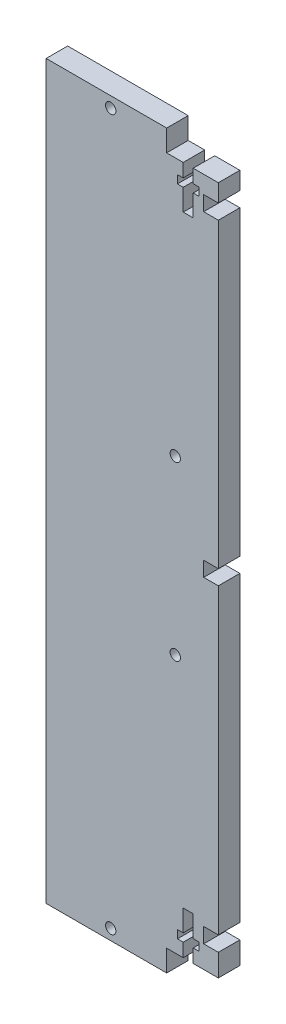
from build123d import *

# Parameters (mm, degrees)
SKETCH1_W                                   = 152.4
SKETCH1_H                                   = 215.9
BOSS_EXTRUDE1_DEPTH                         = 6.35
SKETCH2_R                                   = 1.524
CUT_EXTRUDE1_DEPTH                          = 265.346160366
SKETCH4_R                                   = 1.524
CUT_EXTRUDE2_DEPTH                          = 265.346160366
SKETCH5_R                                   = 1.524
CUT_EXTRUDE3_DEPTH                          = 265.346160366
SKETCH9_W                                   = 81.28
SKETCH9_H                                   = 6.35
CUT_EXTRUDE9_DEPTH                          = 265.346160366
CUT_EXTRUDE10_DEPTH                         = 265.346160366
SKETCH11_W                                  = 50.8
SKETCH11_H                                  = 203.2
CUT_EXTRUDE11_DEPTH                         = 61.976
SKETCH13_W                                  = 4.318
SKETCH13_H                                  = 4.439032047
SKETCH13_H_2                                = 4.376890529
CUT_EXTRUDE12_DEPTH                         = 6.35
SKETCH14_W                                  = 4.318
SKETCH14_H                                  = 4.368724603
CUT_EXTRUDE13_DEPTH                         = 6.35
SKETCH15_W                                  = 125.806146595
SKETCH15_H                                  = 228.6
GETTING_RID_OF_TOP_IMPINGES_WITH_DOOR_DEPTH = 265.346160366


with BuildPart() as part:
    # Sketch1 → Boss-Extrude1 (new body)
    with BuildSketch(Plane.XY):
        with Locations((76.2, 107.95)):
            Rectangle(SKETCH1_W, SKETCH1_H)
    extrude(amount=BOSS_EXTRUDE1_DEPTH)

    # Sketch2 → Cut-Extrude1 (cut, through all)
    with BuildSketch(Plane.XY.offset(6.35)):
        with Locations((19.05, 212.725)):
            Circle(SKETCH2_R)
        with Locations(Location((133.35, 212.725, 0), (0, 0, 180))):
            Circle(SKETCH2_R)
        with Locations((133.35, 3.175)):
            Circle(SKETCH2_R)
        with Locations(Location((19.05, 3.175, 0), (0, 0, 180))):
            Circle(SKETCH2_R)
    extrude(amount=-CUT_EXTRUDE1_DEPTH, mode=Mode.SUBTRACT)

    # Sketch4 → Cut-Extrude2 (cut, through all)
    with BuildSketch(Plane.XY.offset(6.35)):
        with Locations(Location((95.25, 133.35, 0), (0, 0, 180))):
            Circle(SKETCH4_R)
        with Locations((95.25, 82.55)):
            Circle(SKETCH4_R)
    extrude(amount=-CUT_EXTRUDE2_DEPTH, mode=Mode.SUBTRACT)

    # Sketch5 → Cut-Extrude3 (cut, through all)
    with BuildSketch(Plane.XY.offset(6.35)):
        with Locations((38.1, 133.35)):
            Circle(SKETCH5_R)
        with Locations(Location((38.1, 82.55, 0), (0, 0, 180))):
            Circle(SKETCH5_R)
    extrude(amount=-CUT_EXTRUDE3_DEPTH, mode=Mode.SUBTRACT)

    # Sketch9 → Cut-Extrude9 (cut, through all)
    with BuildSketch(Plane(origin=(0, 0, 0), x_dir=(-1, 0, 0), z_dir=(0, 0, -1))):
        with Locations((-76.2, 212.725)):
            Rectangle(SKETCH9_W, SKETCH9_H)
        with Locations((-76.2, 3.175)):
            Rectangle(SKETCH9_W, SKETCH9_H)
    extrude(amount=-CUT_EXTRUDE9_DEPTH, mode=Mode.SUBTRACT)

    # Sketch10 → Cut-Extrude10 (cut, through all)
    with BuildSketch(Plane(origin=(0, 0, 0), x_dir=(-1, 0, 0), z_dir=(0, 0, -1))):
        Polygon((-111.9632, 6.35), (-109.0168, 6.35), (-109.0168, 10.31875), (-107.315, 10.31875), (-107.315, 12.7), (-109.0168, 12.7), (-109.0168, 19.05), (-111.9632, 19.05), (-111.9632, 12.7), (-113.665, 12.7), (-113.665, 10.31875), (-111.9632, 10.31875), align=None)
        Polygon((-107.315, 205.58125), (-107.315, 203.2), (-109.0168, 203.2), (-109.0168, 196.85), (-111.9632, 196.85), (-111.9632, 203.2), (-113.665, 203.2), (-113.665, 205.58125), (-111.9632, 205.58125), (-111.9632, 209.55), (-109.0168, 209.55), (-109.0168, 205.58125), align=None)
        Polygon((-43.3832, 205.58125), (-45.085, 205.58125), (-45.085, 203.2), (-43.3832, 203.2), (-43.3832, 196.85), (-40.4368, 196.85), (-40.4368, 203.2), (-38.735, 203.2), (-38.735, 205.58125), (-40.4368, 205.58125), (-40.4368, 209.55), (-43.3832, 209.55), align=None)
        Polygon((-38.735, 10.31875), (-38.735, 12.7), (-40.4368, 12.7), (-40.4368, 19.05), (-43.3832, 19.05), (-43.3832, 12.7), (-45.085, 12.7), (-45.085, 10.31875), (-43.3832, 10.31875), (-43.3832, 6.35), (-40.4368, 6.35), (-40.4368, 10.31875), align=None)
    extrude(amount=-CUT_EXTRUDE10_DEPTH, mode=Mode.SUBTRACT)

    # Sketch11 → Cut-Extrude11 (cut)
    with BuildSketch(Plane(origin=(0, 0, 0), x_dir=(-1, 0, 0), z_dir=(0, 0, -1))):
        with Locations((-76.2, 107.95)):
            Rectangle(SKETCH11_W, SKETCH11_H)
    extrude(amount=-CUT_EXTRUDE11_DEPTH, mode=Mode.SUBTRACT)


with BuildPart() as cut_extrude11_piece_1:
    # of the separate pieces the step leaves, piece 1, a body of its own (cut_extrude11_pieces)
    add(part.part.solids().sort_by_distance((101.6, 209.55, 0))[0])

    # Sketch15 → Getting rid of top, impinges with door (cut, through all)
    with BuildSketch(Plane.XY.offset(6.35)):
        with Locations((143.333722475, 114.3)):
            Rectangle(SKETCH15_W, SKETCH15_H)
    extrude(amount=-GETTING_RID_OF_TOP_IMPINGES_WITH_DOOR_DEPTH, mode=Mode.SUBTRACT)


with BuildPart() as cut_extrude11_piece_2:
    # of the separate pieces the step leaves, piece 2, a body of its own (cut_extrude11_pieces)
    add(part.part.solids().sort_by_distance((0, 0, 0))[0])

    # Sketch13 → Cut-Extrude12 (cut)
    with BuildSketch(Plane(origin=(0, 0, 0), x_dir=(-1, 0, 0), z_dir=(0, 0, -1))):
        with Locations((-48.641, 15.139283389)):
            Rectangle(SKETCH13_W, SKETCH13_H)
        with Locations((-48.641, 202.163626755)):
            Rectangle(SKETCH13_W, SKETCH13_H_2)
    extrude(amount=-CUT_EXTRUDE12_DEPTH, mode=Mode.SUBTRACT)

    # Sketch14 → Cut-Extrude13 (cut)
    with BuildSketch(Plane(origin=(0, 0, 0), x_dir=(-1, 0, 0), z_dir=(0, 0, -1))):
        with Locations((-48.641, 108.744312397)):
            Rectangle(SKETCH14_W, SKETCH14_H)
    extrude(amount=-CUT_EXTRUDE13_DEPTH, mode=Mode.SUBTRACT)


solid = cut_extrude11_piece_2.part
